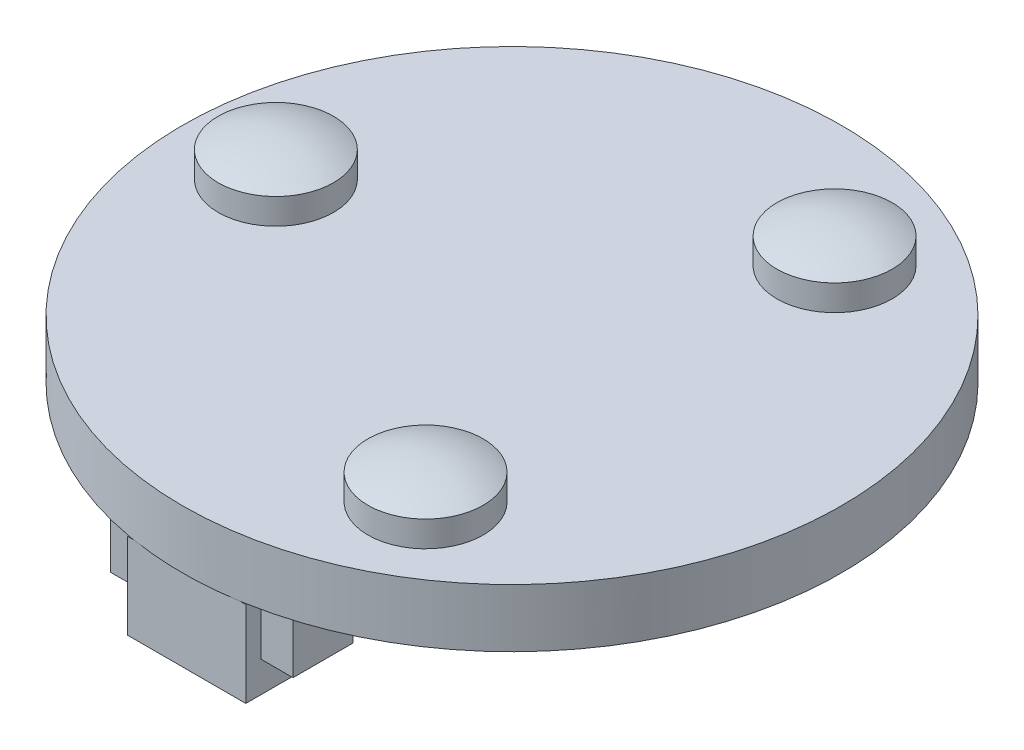
from build123d import *

# Parameters (mm, degrees)
SKETCH1_R                      = 15.35
BOSS_EXTRUDE1_DEPTH            = 2.71
SKETCH2_R                      = 2.685
BOSS_EXTRUDE2_DEPTH            = 1.2
DOME1_FACE_RADIUS              = 2.685
DOME1_HEIGHT                   = 0.6
CIRPATTERN1_COUNT              = 3
CIRPATTERN1_COPY_1_FACE_RADIUS = 2.685
CIRPATTERN1_COPY_1_HEIGHT      = 0.6
CIRPATTERN1_COPY_2_FACE_RADIUS = 2.685
CIRPATTERN1_COPY_2_HEIGHT      = 0.6
BOSS_EXTRUDE3_START            = 2.55
SKETCH3_W                      = 5.5
SKETCH3_H                      = 4.2
SKETCH3_W_2                    = 1.5
SKETCH3_H_2                    = 2.8
BOSS_EXTRUDE3_DEPTH            = 2.55
SKETCH4_W                      = 5.5
SKETCH4_H                      = 4.2
BOSS_EXTRUDE4_DEPTH            = 1.44
CHIP_DEPTH                     = 1.7018


with BuildPart() as part:
    # Sketch1 → Boss-Extrude1 (new body)
    with BuildSketch(Plane(origin=(0, 0, 0), x_dir=(1, 0, 0), z_dir=(0, 1, 0))):
        with Locations(Location((0, 0, 0), (0, 0, 270))):
            Circle(SKETCH1_R)
    extrude(amount=BOSS_EXTRUDE1_DEPTH)

    # Sketch2 → Boss-Extrude2 (add)
    with BuildSketch(Plane(origin=(0, 2.71, 0), x_dir=(-1, 0, 0), z_dir=(0, 1, 0))):
        with Locations(Location((-5.5, 9.526279442, 0), (0, 0, 90))):
            Circle(SKETCH2_R)
    boss_extrude2 = extrude(amount=BOSS_EXTRUDE2_DEPTH)

    # Dome1: a dome of height H over a round flat face of radius A is a cap of a sphere of radius (A * A + H * H) / (2 * H)
    dome1_r = (DOME1_FACE_RADIUS * DOME1_FACE_RADIUS + DOME1_HEIGHT * DOME1_HEIGHT) / (2 * DOME1_HEIGHT)
    dome1_base = Plane((5.5, 3.91, 9.526279442), z_dir=(0, 1, 0))
    with Locations(dome1_base.offset(DOME1_HEIGHT - dome1_r)):
        dome1_ball = Sphere(dome1_r, mode=Mode.PRIVATE)
    add(split(dome1_ball, bisect_by=dome1_base, keep=Keep.TOP, mode=Mode.PRIVATE))

    # CirPattern1: Boss-Extrude2 ×3 about axis
    cirpattern1_axis = Axis((0, 0, 0), (0, 1, 0))
    for i in range(1, CIRPATTERN1_COUNT):
        add(boss_extrude2.rotate(cirpattern1_axis, i * 360 / CIRPATTERN1_COUNT))

    # CirPattern1 copy 1: a dome of height H over a round flat face of radius A is a cap of a sphere of radius (A * A + H * H) / (2 * H)
    cirpattern1_copy_1_r = (CIRPATTERN1_COPY_1_FACE_RADIUS * CIRPATTERN1_COPY_1_FACE_RADIUS + CIRPATTERN1_COPY_1_HEIGHT * CIRPATTERN1_COPY_1_HEIGHT) / (2 * CIRPATTERN1_COPY_1_HEIGHT)
    cirpattern1_copy_1_base = Plane((5.5, 3.91, -9.526279442), z_dir=(0, 1, 0))
    with Locations(cirpattern1_copy_1_base.offset(CIRPATTERN1_COPY_1_HEIGHT - cirpattern1_copy_1_r)):
        cirpattern1_copy_1_ball = Sphere(cirpattern1_copy_1_r, mode=Mode.PRIVATE)
    add(split(cirpattern1_copy_1_ball, bisect_by=cirpattern1_copy_1_base, keep=Keep.TOP, mode=Mode.PRIVATE))

    # CirPattern1 copy 2: a dome of height H over a round flat face of radius A is a cap of a sphere of radius (A * A + H * H) / (2 * H)
    cirpattern1_copy_2_r = (CIRPATTERN1_COPY_2_FACE_RADIUS * CIRPATTERN1_COPY_2_FACE_RADIUS + CIRPATTERN1_COPY_2_HEIGHT * CIRPATTERN1_COPY_2_HEIGHT) / (2 * CIRPATTERN1_COPY_2_HEIGHT)
    cirpattern1_copy_2_base = Plane((-11, 3.91, 0), z_dir=(0, 1, 0))
    with Locations(cirpattern1_copy_2_base.offset(CIRPATTERN1_COPY_2_HEIGHT - cirpattern1_copy_2_r)):
        cirpattern1_copy_2_ball = Sphere(cirpattern1_copy_2_r, mode=Mode.PRIVATE)
    add(split(cirpattern1_copy_2_ball, bisect_by=cirpattern1_copy_2_base, keep=Keep.TOP, mode=Mode.PRIVATE))

    # Sketch3 → Boss-Extrude3 (add)
    with BuildSketch(Plane.XZ.offset(BOSS_EXTRUDE3_START)):
        with Locations((0, 13.05)):
            Rectangle(SKETCH3_W, SKETCH3_H)
        with Locations((0, -13.05)):
            Rectangle(SKETCH3_W, SKETCH3_H)
        with Locations((3.5, 13.05)):
            Rectangle(SKETCH3_W_2, SKETCH3_H_2)
        with Locations((-3.5, 13.05)):
            Rectangle(SKETCH3_W_2, SKETCH3_H_2)
        with Locations((3.5, -13.05)):
            Rectangle(SKETCH3_W_2, SKETCH3_H_2)
        with Locations((-3.5, -13.05)):
            Rectangle(SKETCH3_W_2, SKETCH3_H_2)
        with BuildLine():
            Line((2.75, 15.101655538), (2.75, 15.15))
            Line((2.75, 15.15), (2.469817807, 15.15))
            ThreePointArc((2.469817807, 15.15), (2.610020839, 15.126476497), (2.75, 15.101655538))
        make_face()
        with BuildLine():
            ThreePointArc((-2.75, 15.101655538), (-2.610020839, 15.126476497), (-2.469817807, 15.15))
            Line((-2.469817807, 15.15), (-2.75, 15.15))
            Line((-2.75, 15.15), (-2.75, 15.101655538))
        make_face()
        with BuildLine():
            ThreePointArc((-2.469817807, -15.15), (-2.610020839, -15.126476497), (-2.75, -15.101655538))
            Line((-2.75, -15.101655538), (-2.75, -15.15))
            Line((-2.75, -15.15), (-2.469817807, -15.15))
        make_face()
        with BuildLine():
            Line((2.75, -15.15), (2.75, -15.101655538))
            ThreePointArc((2.75, -15.101655538), (2.610020839, -15.126476497), (2.469817807, -15.15))
            Line((2.469817807, -15.15), (2.75, -15.15))
        make_face()
    extrude(amount=-BOSS_EXTRUDE3_DEPTH)

    # Sketch4 → Boss-Extrude4 (add)
    with BuildSketch(Plane.XZ.offset(2.55)):
        Polygon((-2.75, 10.95), (2.75, 10.95), (2.75, 11.65), (2.75, 14.45), (2.75, 15.15), (-2.75, 15.15), (-2.75, 14.45), (-2.75, 11.65), align=None)
        with Locations((0, -13.05)):
            Rectangle(SKETCH4_W, SKETCH4_H)
    extrude(amount=BOSS_EXTRUDE4_DEPTH)

    # Sketch5 → Chip (add)
    with BuildSketch(Plane.XZ):
        Polygon((-5.1644, -9.425953844), (-2.016601499, -2.878979584), (-8.014179317, 0.004667994), (-11.161977818, -6.542306266), align=None)
    extrude(amount=CHIP_DEPTH)


solid = part.part
